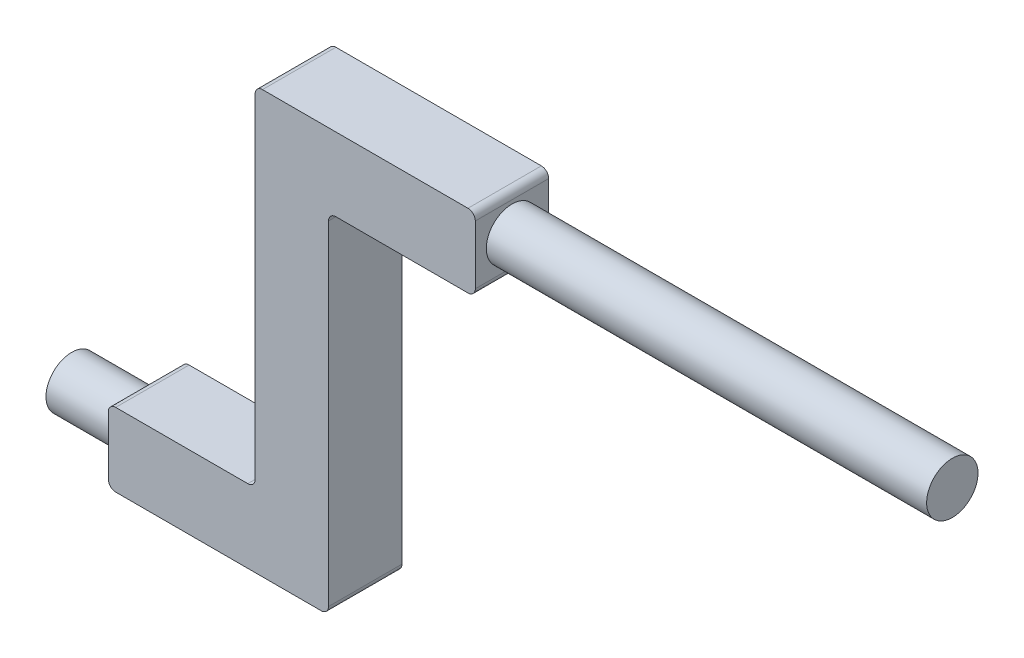
from build123d import *

# Parameters (mm, degrees)
BOSS_EXTRUDE2_DEPTH = 10
SKETCH3_R           = 3.5
BOSS_EXTRUDE3_DEPTH = 60
SKETCH4_R           = 3.5
BOSS_EXTRUDE4_DEPTH = 10


with BuildPart() as part:
    # Sketch1 → Boss-Extrude2 (new body)
    with BuildSketch(Plane.XY):
        with BuildLine():
            Line((0, 22.75), (0, -22.75))
            ThreePointArc((0, -22.75), (-0.292893219, -23.457106781), (-1, -23.75))
            Line((-1, -23.75), (-29, -23.75))
            ThreePointArc((-29, -23.75), (-29.707106781, -23.457106781), (-30, -22.75))
            Line((-30, -22.75), (-30, -14.75))
            ThreePointArc((-30, -14.75), (-29.707106781, -14.042893219), (-29, -13.75))
            Line((-29, -13.75), (-11, -13.75))
            ThreePointArc((-11, -13.75), (-10.292893219, -13.457106781), (-10, -12.75))
            Line((-10, -12.75), (-10, 32.75))
            ThreePointArc((-10, 32.75), (-9.707106781, 33.457106781), (-9, 33.75))
            Line((-9, 33.75), (19, 33.75))
            ThreePointArc((19, 33.75), (19.707106781, 33.457106781), (20, 32.75))
            Line((20, 32.75), (20, 24.75))
            ThreePointArc((20, 24.75), (19.707106781, 24.042893219), (19, 23.75))
            Line((19, 23.75), (1, 23.75))
            ThreePointArc((1, 23.75), (0.292893219, 23.457106781), (0, 22.75))
        make_face()
    extrude(amount=BOSS_EXTRUDE2_DEPTH)

    # Sketch3 → Boss-Extrude3 (add)
    with BuildSketch(Plane(origin=(20, 0, 0), x_dir=(0, 0, -1), z_dir=(1, 0, 0))):
        with Locations(Location((-5, 28.75, 0), (0, 0, 270))):
            Circle(SKETCH3_R)
    extrude(amount=BOSS_EXTRUDE3_DEPTH)

    # Sketch4 → Boss-Extrude4 (add)
    with BuildSketch(Plane.ZY.offset(30)):
        with Locations(Location((5, -18.75, 0), (0, 0, 90))):
            Circle(SKETCH4_R)
    extrude(amount=BOSS_EXTRUDE4_DEPTH)


solid = part.part
